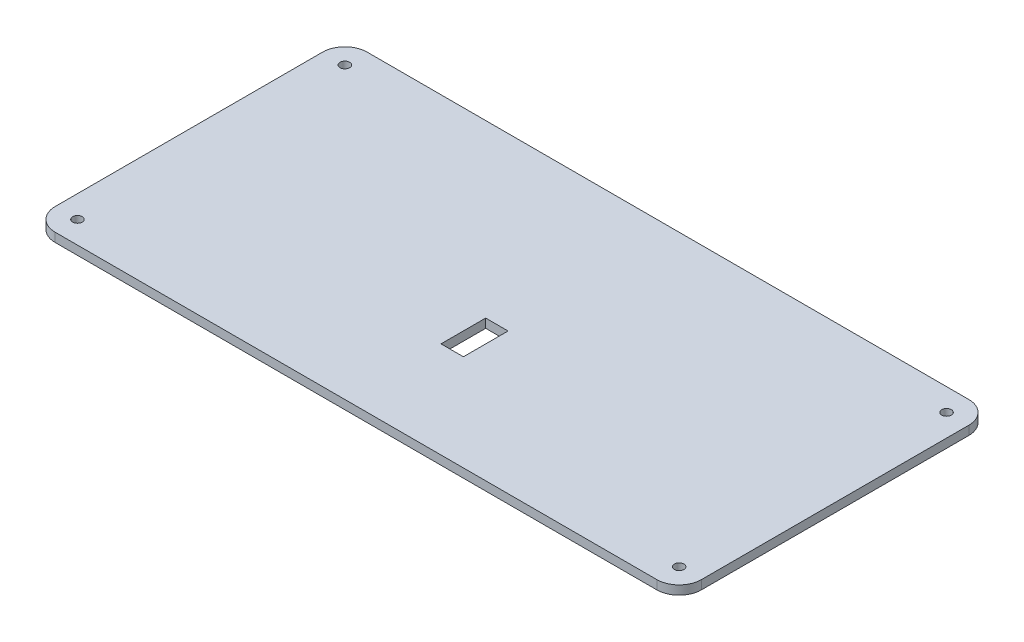
from build123d import *

# Parameters (mm, degrees)
SKETCH1_R               = 2.15
BOSS_EXTRUDE1_DEPTH     = 4
MIRROR2_COPY_1_SKETCH_R = 2.15
MIRROR2_COPY_1_DEPTH    = 4
SKETCH2_W               = 10.05
SKETCH2_H               = 20.05
CUT_EXTRUDE5_DEPTH      = 162.062099825


with BuildPart() as part:
    # Sketch1 → Boss-Extrude1 (new body)
    with BuildSketch(Plane(origin=(0, 0, 0), x_dir=(1, 0, 0), z_dir=(0, 1, 0))):
        with BuildLine():
            Line((135, -70), (0, -70))
            Line((0, -70), (0, 0))
            Line((0, 0), (145, 0))
            Line((145, 0), (145, -60))
            ThreePointArc((145, -60), (142.071067812, -67.071067812), (135, -70))
        make_face()
        with Locations(Location((135, -60, 0), (0, 0, 270))):
            Circle(SKETCH1_R, mode=Mode.SUBTRACT)
    boss_extrude1 = extrude(amount=BOSS_EXTRUDE1_DEPTH)

    # Mirror1: Boss-Extrude1 across plane
    add(boss_extrude1.mirror(Plane(origin=(0, 0, 0), x_dir=(0, 0, 1), z_dir=(1, 0, 0))))

    # Mirror2: Boss-Extrude1 across plane
    add(boss_extrude1.mirror(Plane.XY))

    # Mirror2 copy 1 sketch → Mirror2 copy 1 (add)
    with BuildSketch(Plane(origin=(0, 0, 0), x_dir=(-1, 0, 0), z_dir=(0, 1, 0))):
        with BuildLine():
            Line((135, -70), (0, -70))
            Line((0, -70), (0, 0))
            Line((0, 0), (145, 0))
            Line((145, 0), (145, -60))
            ThreePointArc((145, -60), (142.071067812, -67.071067812), (135, -70))
        make_face()
        with Locations(Location((135, -60, 0), (0, 0, 270))):
            Circle(MIRROR2_COPY_1_SKETCH_R, mode=Mode.SUBTRACT)
    extrude(amount=MIRROR2_COPY_1_DEPTH)

    # Sketch2 → Cut-Extrude5 (cut, through all)
    with BuildSketch(Plane(origin=(0, 4, 0), x_dir=(1, 0, 0), z_dir=(0, 1, 0))):
        with Locations((-0.025, -16.784138883)):
            Rectangle(SKETCH2_W, SKETCH2_H)
    extrude(amount=-CUT_EXTRUDE5_DEPTH, mode=Mode.SUBTRACT)


solid = part.part
